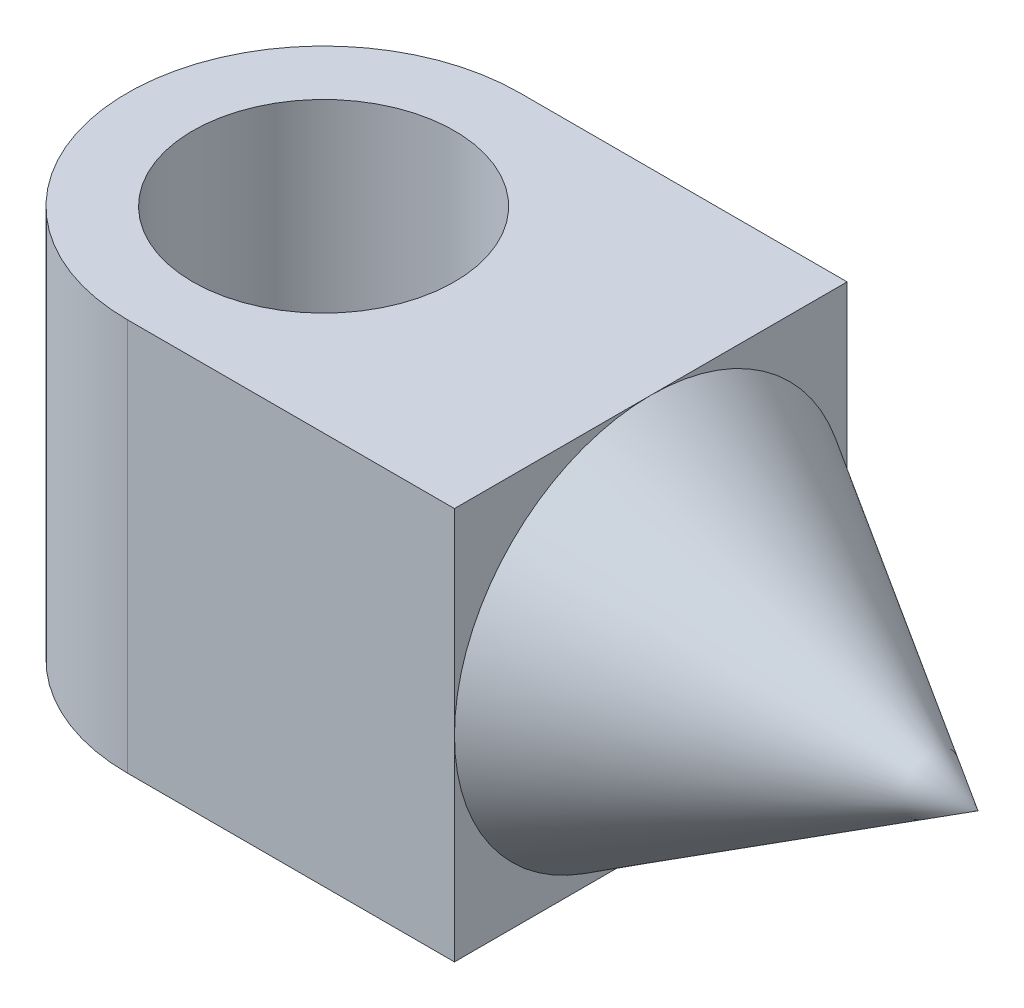
from build123d import *

# Parameters (mm, degrees)
BOSS_EXTRUDE2_DEPTH      = 15
BOSS_EXTRUDE2_DEPTH_BACK = 15
SKETCH1_R                = 10


with BuildPart() as part:
    # Sketch1 → Boss-Extrude2 (new, two sides: drawn at the far end of the back side and taken through both)
    with BuildSketch(Plane(origin=(0, 0, 0), x_dir=(1, 0, 0), z_dir=(0, 1, 0)).offset(-BOSS_EXTRUDE2_DEPTH_BACK)):
        with BuildLine():
            Line((0, 15), (-25, 15))
            ThreePointArc((-25, 15), (-40, 0), (-25, -15))
            Line((-25, -15), (0, -15))
            Line((0, -15), (0, 0))
            Line((0, 0), (0, 15))
        make_face()
        with Locations((-25, 0)):
            Circle(SKETCH1_R, mode=Mode.SUBTRACT)
    extrude(amount=BOSS_EXTRUDE2_DEPTH + BOSS_EXTRUDE2_DEPTH_BACK)

    # Sketch1<4> → Revolve2 (revolve)
    with BuildSketch(Plane(origin=(0, 0, 0), x_dir=(1, 0, 0), z_dir=(0, 1, 0))):
        Polygon((25, 0), (0, 15), (0, 0), align=None)
    revolve(axis=Axis((0, 0, 0), (1, 0, 0)))


solid = part.part
